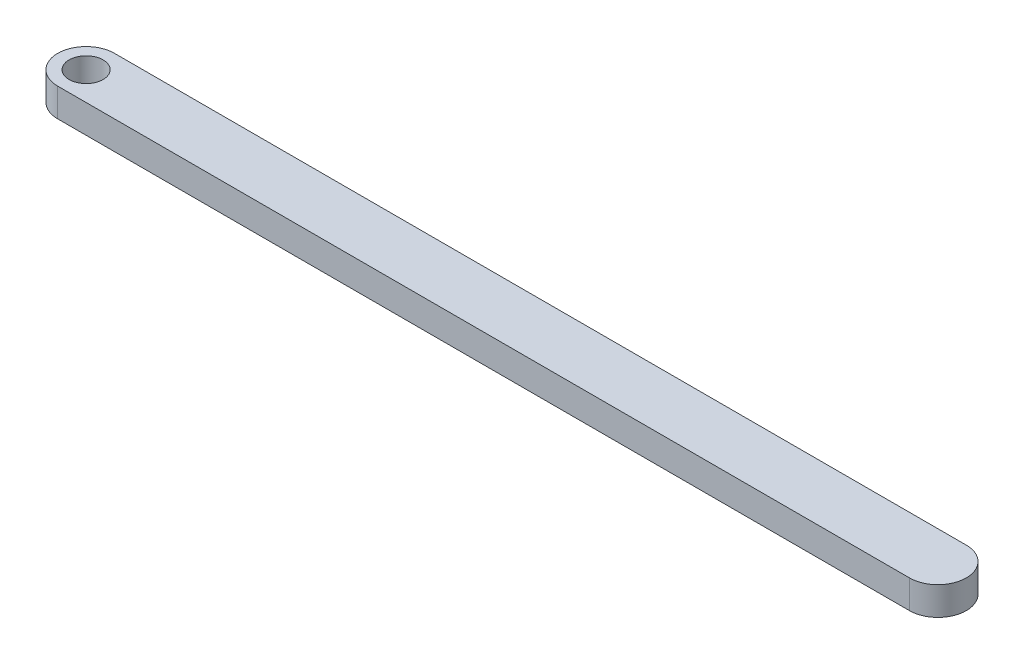
from build123d import *

# Parameters (mm, degrees)
SKETCH_1_R      = 3
EXTRUDE_1_DEPTH = 5


with BuildPart() as part:
    # 草图1 → 凸台-拉伸1 (new body)
    with BuildSketch(Plane(origin=(0, 0, 0), x_dir=(1, 0, 0), z_dir=(0, 1, 0))):
        with BuildLine():
            Line((0, 0), (150, 0))
            ThreePointArc((150, 0), (155, -5), (150, -10))
            Line((150, -10), (0, -10))
            ThreePointArc((0, -10), (-5, -5), (0, 0))
        make_face()
        with Locations(Location((0, -5, 0), (0, 0, 270))):
            Circle(SKETCH_1_R, mode=Mode.SUBTRACT)
    extrude(amount=EXTRUDE_1_DEPTH)


solid = part.part
